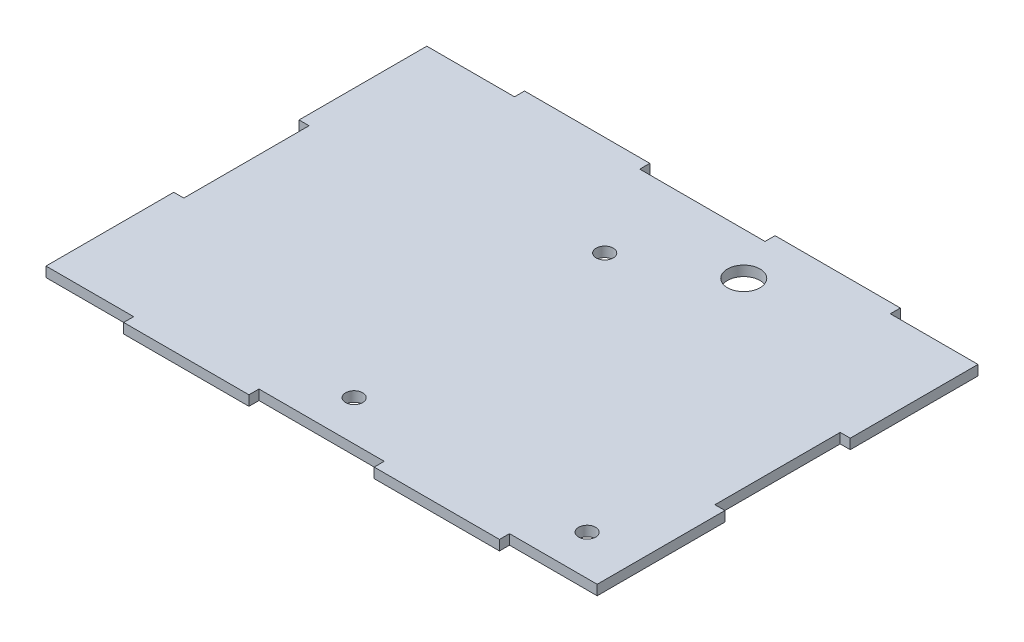
from build123d import *

# Parameters (mm, degrees)
BOSS_EXTRUDE1_DEPTH = 4
SKETCH3_R           = 3.41
CUT_EXTRUDE1_DEPTH  = 137.073509545
SKETCH4_R           = 6.5
CUT_EXTRUDE2_DEPTH  = 137.073509545


with BuildPart() as part:
    # Sketch2 → Boss-Extrude1 (new body)
    with BuildSketch(Plane(origin=(0, 0, 0), x_dir=(1, 0, 0), z_dir=(0, 1, 0))):
        Polygon((-110, 76), (-110, 25), (-106, 25), (-106, -25), (-110, -25), (-110, -76), (-75, -76), (-75, -80), (-25, -80), (-25, -76), (25, -76), (25, -80), (75, -80), (75, -76), (110, -76), (110, -25), (106, -25), (106, 25), (110, 25), (110, 76), (75, 76), (75, 80), (25, 80), (25, 76), (-25, 76), (-25, 80), (-75, 80), (-75, 76), align=None)
    extrude(amount=BOSS_EXTRUDE1_DEPTH)

    # Sketch3 → Cut-Extrude1 (cut, through all)
    with BuildSketch(Plane(origin=(0, 4, 0), x_dir=(1, 0, 0), z_dir=(0, 1, 0))):
        with Locations(Location((90, -60, 0), (0, 0, 270))):
            Circle(SKETCH3_R)
        with Locations(Location((-3, -60, 0), (0, 0, 270))):
            Circle(SKETCH3_R)
        with Locations(Location((-3, 40, 0), (0, 0, 270))):
            Circle(SKETCH3_R)
    extrude(amount=-CUT_EXTRUDE1_DEPTH, mode=Mode.SUBTRACT)

    # Sketch4 → Cut-Extrude2 (cut, through all)
    with BuildSketch(Plane(origin=(0, 4, 0), x_dir=(1, 0, 0), z_dir=(0, 1, 0))):
        with Locations(Location((33.5, 59, 0), (0, 0, 270))):
            Circle(SKETCH4_R)
    extrude(amount=-CUT_EXTRUDE2_DEPTH, mode=Mode.SUBTRACT)


solid = part.part
